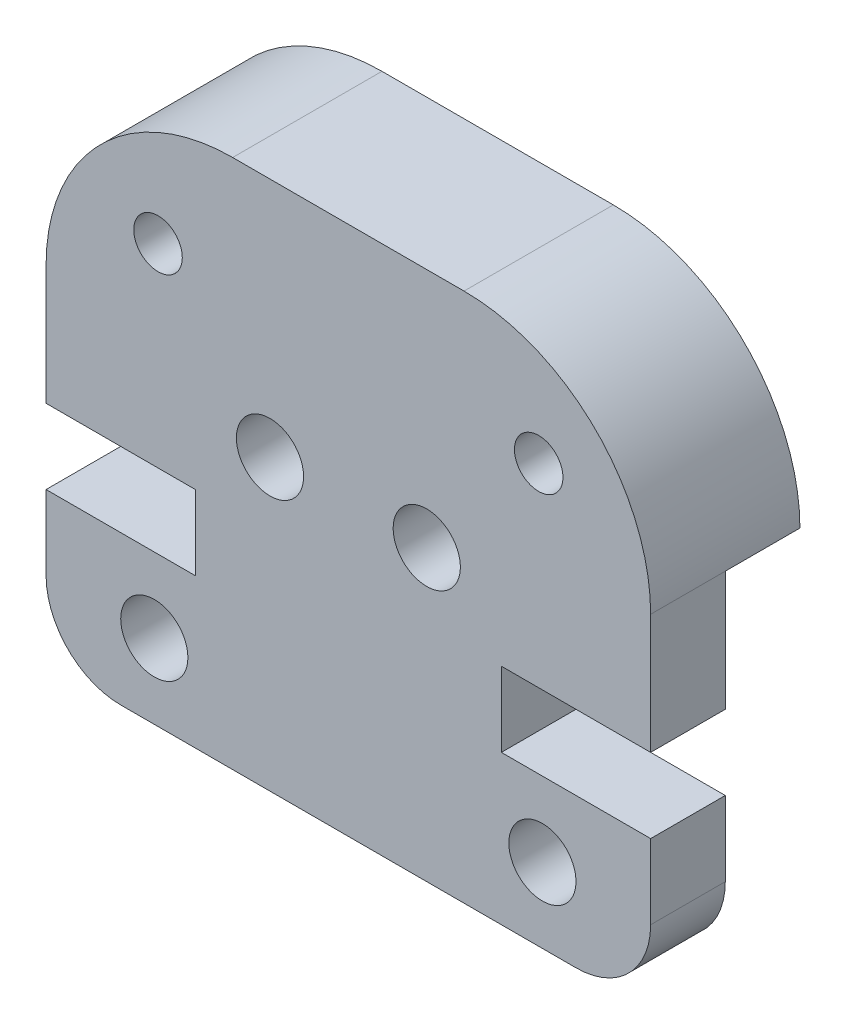
from build123d import *

# Parameters (mm, degrees)
SKETCH1_R           = 0.9
SKETCH1_R_2         = 0.65
BOSS_EXTRUDE1_DEPTH = 4
SKETCH2_W           = 16.2
SKETCH2_H           = 9.205
CUT_EXTRUDE1_DEPTH  = 2


with BuildPart() as part:
    # Sketch1 → Boss-Extrude1 (new body)
    with BuildSketch(Plane.XY):
        with BuildLine():
            Line((12.2, 4), (16.2, 4))
            Line((16.2, 4), (16.2, 2))
            ThreePointArc((16.2, 2), (15.614213562, 0.585786438), (14.2, 0))
            Line((14.2, 0), (2, 0))
            ThreePointArc((2, 0), (0.585786438, 0.585786438), (0, 2))
            Line((0, 2), (0, 4))
            Line((0, 4), (4, 4))
            Line((4, 4), (4, 6))
            Line((4, 6), (0, 6))
            Line((0, 6), (0, 9.205))
            ThreePointArc((0, 9.205), (1.464466094, 12.740533906), (5, 14.205))
            Line((5, 14.205), (11.2, 14.205))
            ThreePointArc((11.2, 14.205), (14.735533906, 12.740533906), (16.2, 9.205))
            Line((16.2, 9.205), (16.2, 6))
            Line((16.2, 6), (12.2, 6))
            Line((12.2, 6), (12.2, 4))
        make_face()
        with Locations(Location((13.3, 2, 0), (0, 0, 180))):
            Circle(SKETCH1_R, mode=Mode.SUBTRACT)
        with Locations(Location((13.2, 11.205, 0), (0, 0, 180))):
            Circle(SKETCH1_R_2, mode=Mode.SUBTRACT)
        with Locations(Location((10.2, 7.75, 0), (0, 0, 180))):
            Circle(SKETCH1_R, mode=Mode.SUBTRACT)
        with Locations((6, 7.75)):
            Circle(SKETCH1_R, mode=Mode.SUBTRACT)
        with Locations((3, 11.205)):
            Circle(SKETCH1_R_2, mode=Mode.SUBTRACT)
        with Locations((2.9, 2)):
            Circle(SKETCH1_R, mode=Mode.SUBTRACT)
    extrude(amount=BOSS_EXTRUDE1_DEPTH)

    # Sketch2 → Cut-Extrude1 (cut)
    with BuildSketch(Plane(origin=(0, 0, 0), x_dir=(-1, 0, 0), z_dir=(0, 0, -1))):
        with Locations((-8.1, 4.6025)):
            Rectangle(SKETCH2_W, SKETCH2_H)
    extrude(amount=-CUT_EXTRUDE1_DEPTH, mode=Mode.SUBTRACT)


solid = part.part
